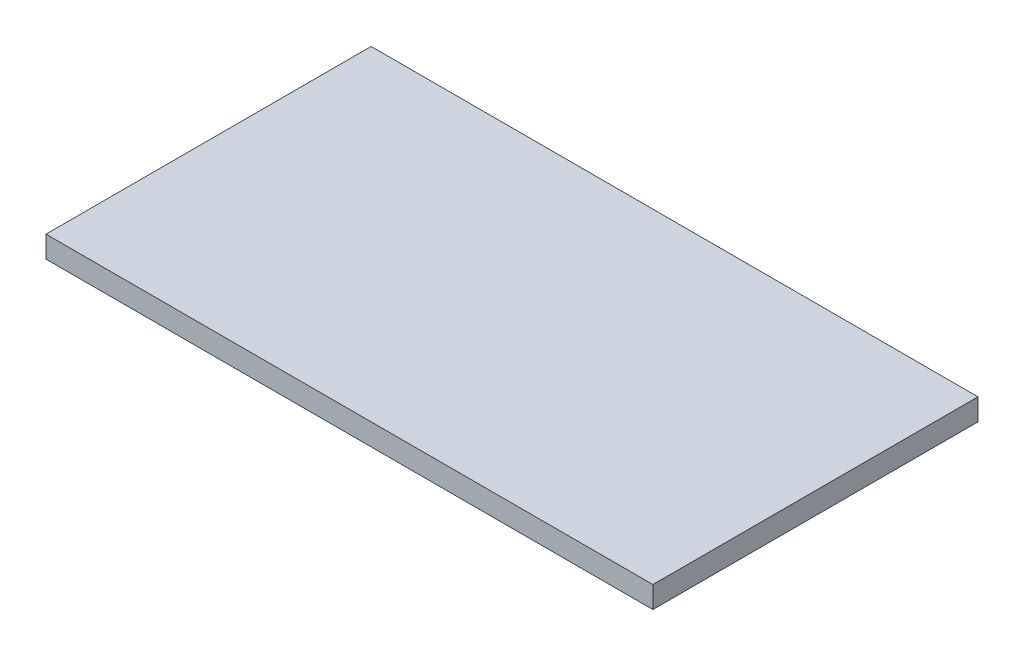
from build123d import *

# Parameters (mm, degrees)
SKETCH1_W           = 1422.4
SKETCH1_H           = 762
BOSS_EXTRUDE1_DEPTH = 50.8


with BuildPart() as part:
    # Sketch1 → Boss-Extrude1 (new body)
    with BuildSketch(Plane(origin=(0, 0, 0), x_dir=(1, 0, 0), z_dir=(0, 1, 0))):
        with Locations((711.2, 381)):
            Rectangle(SKETCH1_W, SKETCH1_H)
    extrude(amount=BOSS_EXTRUDE1_DEPTH)


solid = part.part
